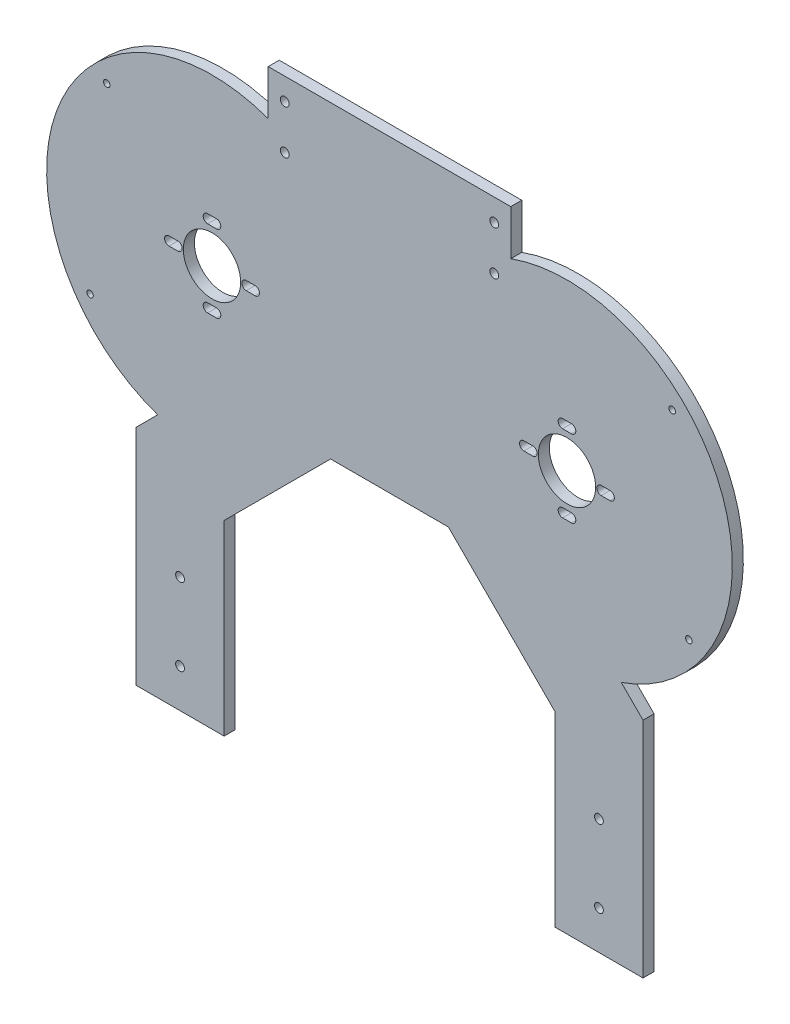
from build123d import *

# Parameters (mm, degrees)
SKETCH1_W           = 110
SKETCH1_H           = 140
SKETCH1_R           = 2
BOSS_EXTRUDE1_DEPTH = 5
SKETCH2_R           = 2
BOSS_EXTRUDE2_DEPTH = 5
SKETCH3_R           = 1.4732
SKETCH3_R_2         = 13
BOSS_EXTRUDE3_DEPTH = 5


with BuildPart() as part:
    # Sketch1 → Boss-Extrude1 (new body)
    with BuildSketch(Plane.XY):
        Rectangle(SKETCH1_W, SKETCH1_H)
        with Locations((-47.5, 40)):
            Circle(SKETCH1_R, mode=Mode.SUBTRACT)
        with Locations((47.5, 40)):
            Circle(SKETCH1_R, mode=Mode.SUBTRACT)
        with Locations((-47.5, 60)):
            Circle(SKETCH1_R, mode=Mode.SUBTRACT)
        with Locations((47.5, 60)):
            Circle(SKETCH1_R, mode=Mode.SUBTRACT)
    extrude(amount=BOSS_EXTRUDE1_DEPTH)

    # Sketch2 → Boss-Extrude2 (add)
    with BuildSketch(Plane.XY):
        Polygon((-26.715730122, -70), (-55, -41.715730122), (-115, -101.715728753), (-115, -203), (-75, -203), (-75, -118.28427098), align=None)
        with Locations((-95, -185.5)):
            Circle(SKETCH2_R, mode=Mode.SUBTRACT)
        with Locations((-95, -150.5)):
            Circle(SKETCH2_R, mode=Mode.SUBTRACT)
    boss_extrude2 = extrude(amount=BOSS_EXTRUDE2_DEPTH)

    # Mirror1: Boss-Extrude2 across plane
    add(boss_extrude2.mirror(Plane(origin=(0, 0, 0), x_dir=(0, 0, 1), z_dir=(1, 0, 0))))

    # Sketch3 → Boss-Extrude3 (add)
    # profile 1 of 2: a face of its own
    with BuildSketch(Plane.XY.offset(5)):
        with BuildLine():
            ThreePointArc((-55, 49.531907673), (-151.188194001, 4.063503923), (-105.126050066, -91.841779044))
            Line((-105.126050066, -91.841779044), (-55, -41.715730122))
            Line((-55, -41.715730122), (-55, 49.531907673))
        make_face()
        with Locations((-135.79276299, -59.716409454)):
            Circle(SKETCH3_R, mode=Mode.SUBTRACT)
        with Locations((-128.22970773, 26.72970773)):
            Circle(SKETCH3_R, mode=Mode.SUBTRACT)
        with BuildLine():
            ThreePointArc((-65, -23), (-67, -21), (-65, -19))
            Line((-65, -19), (-61, -19))
            ThreePointArc((-61, -19), (-59, -21), (-61, -23))
            Line((-61, -23), (-65, -23))
        make_face(mode=Mode.SUBTRACT)
        with BuildLine():
            Line((-78.5, -40.5), (-82.5, -40.5))
            ThreePointArc((-82.5, -40.5), (-84.5, -38.5), (-82.5, -36.5))
            Line((-82.5, -36.5), (-78.5, -36.5))
            ThreePointArc((-78.5, -36.5), (-76.5, -38.5), (-78.5, -40.5))
        make_face(mode=Mode.SUBTRACT)
        with BuildLine():
            ThreePointArc((-96, -19), (-94, -21), (-96, -23))
            Line((-96, -23), (-100, -23))
            ThreePointArc((-100, -23), (-102, -21), (-100, -19))
            Line((-100, -19), (-96, -19))
        make_face(mode=Mode.SUBTRACT)
        with Locations((-80.5, -21)):
            Circle(SKETCH3_R_2, mode=Mode.SUBTRACT)
        with BuildLine():
            ThreePointArc((-82.5, -5.5), (-84.5, -3.5), (-82.5, -1.5))
            Line((-82.5, -1.5), (-78.5, -1.5))
            ThreePointArc((-78.5, -1.5), (-76.5, -3.5), (-78.5, -5.5))
            Line((-78.5, -5.5), (-82.5, -5.5))
        make_face(mode=Mode.SUBTRACT)
    # profile 2 of 2: a face of its own
    with BuildSketch(Plane.XY.offset(5)):
        with BuildLine():
            ThreePointArc((105.126050066, -91.841779044), (151.188194001, 4.063503923), (55, 49.531907673))
            Line((55, 49.531907673), (55, -41.715730122))
            Line((55, -41.715730122), (105.126050066, -91.841779044))
        make_face()
        with Locations((135.79276299, -59.716409454)):
            Circle(SKETCH3_R, mode=Mode.SUBTRACT)
        with Locations((128.22970773, 26.72970773)):
            Circle(SKETCH3_R, mode=Mode.SUBTRACT)
        with BuildLine():
            ThreePointArc((82.5, -1.5), (84.5, -3.5), (82.5, -5.5))
            Line((82.5, -5.5), (78.5, -5.5))
            ThreePointArc((78.5, -5.5), (76.5, -3.5), (78.5, -1.5))
            Line((78.5, -1.5), (82.5, -1.5))
        make_face(mode=Mode.SUBTRACT)
        with BuildLine():
            ThreePointArc((65, -19), (67, -21), (65, -23))
            Line((65, -23), (61, -23))
            ThreePointArc((61, -23), (59, -21), (61, -19))
            Line((61, -19), (65, -19))
        make_face(mode=Mode.SUBTRACT)
        with BuildLine():
            ThreePointArc((82.5, -36.5), (84.5, -38.5), (82.5, -40.5))
            Line((82.5, -40.5), (78.5, -40.5))
            ThreePointArc((78.5, -40.5), (76.5, -38.5), (78.5, -36.5))
            Line((78.5, -36.5), (82.5, -36.5))
        make_face(mode=Mode.SUBTRACT)
        with Locations((80.5, -21)):
            Circle(SKETCH3_R_2, mode=Mode.SUBTRACT)
        with BuildLine():
            Line((100, -23), (96, -23))
            ThreePointArc((96, -23), (94, -21), (96, -19))
            Line((96, -19), (100, -19))
            ThreePointArc((100, -19), (102, -21), (100, -23))
        make_face(mode=Mode.SUBTRACT)
    extrude(amount=-BOSS_EXTRUDE3_DEPTH)


solid = part.part
